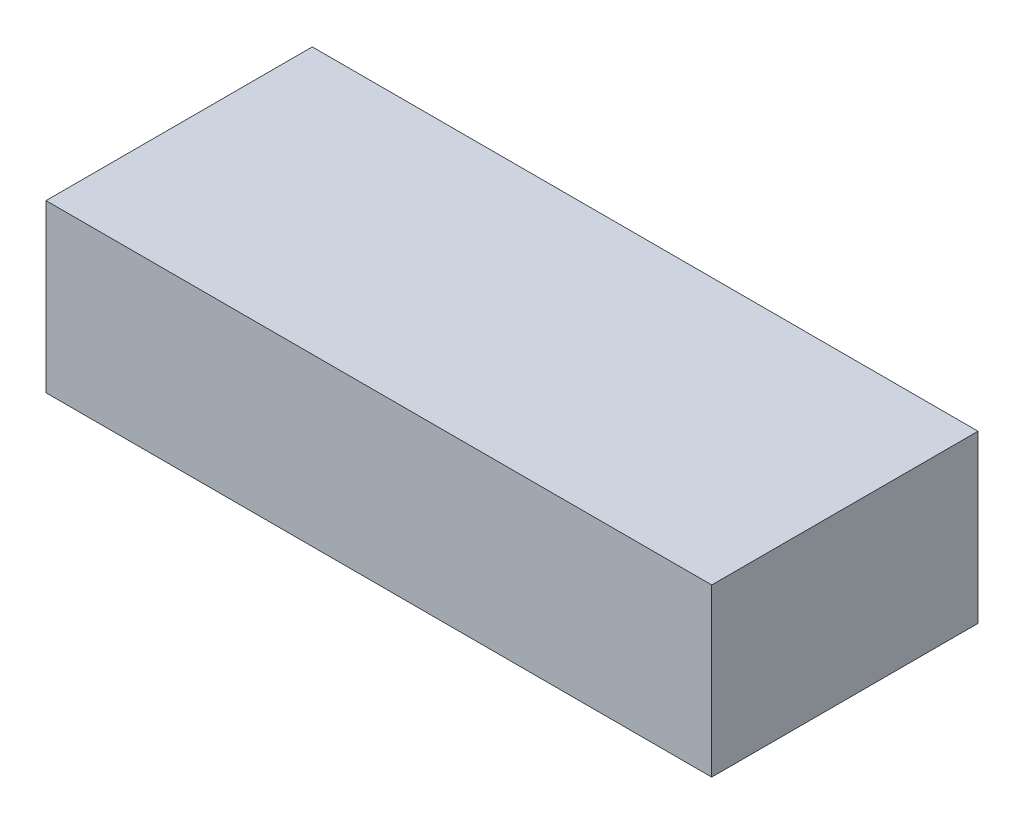
from build123d import *

# Parameters (mm, degrees)
SK_P01_YADAPTER_W  = 40
SK_P01_YADAPTER_H  = 16
P01_YADAPTER_DEPTH = 10


with BuildPart() as part:
    # SK_P01_Yadapter → P01_Yadapter (new body)
    with BuildSketch(Plane(origin=(0, 0, 0), x_dir=(1, 0, 0), z_dir=(0, 1, 0))):
        Rectangle(SK_P01_YADAPTER_W, SK_P01_YADAPTER_H)
    extrude(amount=P01_YADAPTER_DEPTH)


solid = part.part
